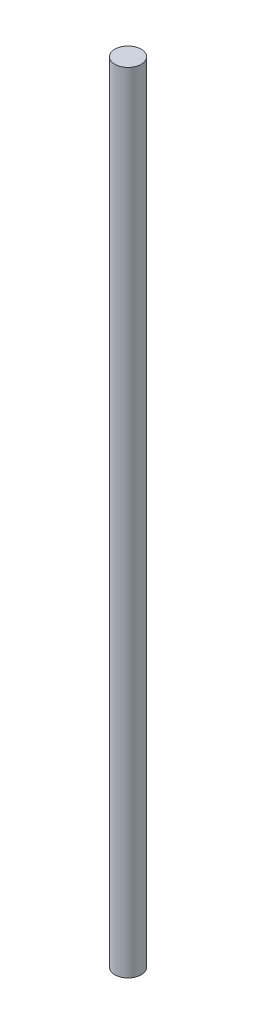
from build123d import *

# Parameters (mm, degrees)
SKETCH_1_R      = 1.5
EXTRUDE_1_DEPTH = 90


with BuildPart() as part:
    # 草图1 → 凸台-拉伸1 (new body)
    with BuildSketch(Plane(origin=(0, 0, 0), x_dir=(1, 0, 0), z_dir=(0, 1, 0))):
        with Locations(Location((0, 0, 0), (0, 0, 90))):
            Circle(SKETCH_1_R)
    extrude(amount=EXTRUDE_1_DEPTH)


solid = part.part
